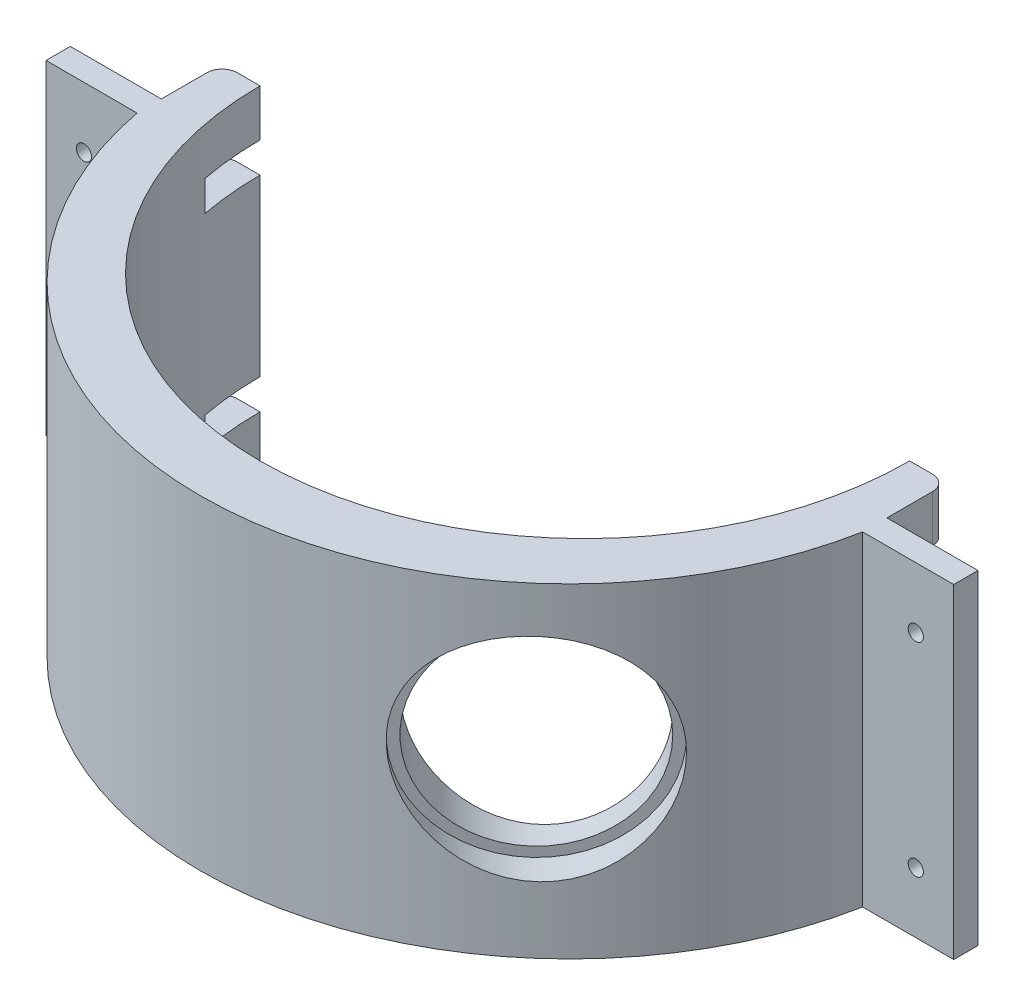
from build123d import *

# Parameters (mm, degrees)
BOSS_EXTRUDE1_DEPTH = 107
SKETCH2_R           = 2.5
CUT_EXTRUDE1_DEPTH  = 336.0337743
SKETCH3_R           = 35
CUT_EXTRUDE2_DEPTH  = 10
SKETCH4_R           = 31.778321021
CUT_EXTRUDE3_DEPTH  = 25
CUT_EXTRUDE4_REACH  = 337.034
SKETCH5_W           = 15.542799326
SKETCH5_H           = 10
SKETCH5_W_2         = 18.63674205


with BuildPart() as part:
    # Sketch1 → Boss-Extrude1 (new body)
    with BuildSketch(Plane(origin=(0, 0, 0), x_dir=(1, 0, 0), z_dir=(0, 1, 0))):
        with BuildLine():
            Line((0, 0), (0, -8))
            Line((0, -8), (30, -8))
            ThreePointArc((30, -8), (149.5, -106.759683035), (269, -8))
            Line((269, -8), (299, -8))
            Line((299, -8), (299, 0))
            Line((299, 0), (269, 0))
            Line((269, 0), (269, 15))
            ThreePointArc((269, 15), (267.535533906, 18.535533906), (264, 20))
            Line((264, 20), (256.5, 20))
            ThreePointArc((256.5, 20), (149.5, -87.000008561), (42.5, 20))
            Line((42.5, 20), (35, 20))
            ThreePointArc((35, 20), (31.464466094, 18.535533906), (30, 15))
            Line((30, 15), (30, 0))
            Line((30, 0), (0, 0))
        make_face()
    extrude(amount=BOSS_EXTRUDE1_DEPTH)

    # Sketch2 → Cut-Extrude1 (cut, through all)
    with BuildSketch(Plane(origin=(0, 0, 0), x_dir=(-1, 0, 0), z_dir=(0, 0, -1))):
        with Locations((-286.5, 87)):
            Circle(SKETCH2_R)
        with Locations((-286.5, 20)):
            Circle(SKETCH2_R)
        with Locations((-12.5, 87)):
            Circle(SKETCH2_R)
        with Locations((-12.5, 20)):
            Circle(SKETCH2_R)
    extrude(amount=-CUT_EXTRUDE1_DEPTH, mode=Mode.SUBTRACT)

    # Sketch3 → Cut-Extrude2 (cut)
    with BuildSketch(Plane(origin=(152.698962186, 0, 153.519285181), x_dir=(0.7089984938103423, 0, -0.7052099940972661), z_dir=(0.7052099940972661, 0, 0.7089984938103423))):
        with Locations((109.109605527, 56.865799068)):
            Circle(SKETCH3_R)
    extrude(amount=-CUT_EXTRUDE2_DEPTH, mode=Mode.SUBTRACT)

    # Sketch4 → Cut-Extrude3 (cut)
    with BuildSketch(Plane(origin=(145.646862245, 0, 146.429300243), x_dir=(0.7089984938103423, 0, -0.7052099940972661), z_dir=(0.7052099940972661, 0, 0.7089984938103423))):
        with Locations((109.109605527, 56.865799068)):
            Circle(SKETCH4_R)
    extrude(amount=-CUT_EXTRUDE3_DEPTH, mode=Mode.SUBTRACT)

    # Cut-Extrude4: up to this face of the body (flat: up to its plane)
    cut_extrude4_end = Plane(part.part.faces().sort_by_distance((260.25, 53.5, -20))[0])
    # Sketch5 → Cut-Extrude4 (cut, up to the picked face)
    with BuildSketch(Plane(origin=(0, 0, 0), x_dir=(-1, 0, 0), z_dir=(0, 0, -1)), mode=Mode.PRIVATE) as cut_extrude4_sk1:
        with Locations((-261.228600337, 86.535453814)):
            Rectangle(SKETCH5_W, SKETCH5_H)
    cut_extrude4_tool1 = split(extrude(cut_extrude4_sk1.sketch, amount=CUT_EXTRUDE4_REACH, mode=Mode.PRIVATE), bisect_by=cut_extrude4_end, keep=Keep.BOTH, mode=Mode.PRIVATE)
    # Sketch5 → Cut-Extrude4 (cut, up to the picked face)
    with BuildSketch(Plane(origin=(0, 0, 0), x_dir=(-1, 0, 0), z_dir=(0, 0, -1)), mode=Mode.PRIVATE) as cut_extrude4_sk2:
        with Locations((-259.681628975, 19.008712967)):
            Rectangle(SKETCH5_W_2, SKETCH5_H)
    cut_extrude4_tool2 = split(extrude(cut_extrude4_sk2.sketch, amount=CUT_EXTRUDE4_REACH, mode=Mode.PRIVATE), bisect_by=cut_extrude4_end, keep=Keep.BOTH, mode=Mode.PRIVATE)
    # Sketch5 → Cut-Extrude4 (cut, up to the picked face)
    with BuildSketch(Plane(origin=(0, 0, 0), x_dir=(-1, 0, 0), z_dir=(0, 0, -1)), mode=Mode.PRIVATE) as cut_extrude4_sk3:
        with Locations((-39.318371025, 19.008712967)):
            Rectangle(SKETCH5_W_2, SKETCH5_H)
    cut_extrude4_tool3 = split(extrude(cut_extrude4_sk3.sketch, amount=CUT_EXTRUDE4_REACH, mode=Mode.PRIVATE), bisect_by=cut_extrude4_end, keep=Keep.BOTH, mode=Mode.PRIVATE)
    # Sketch5 → Cut-Extrude4 (cut, up to the picked face)
    with BuildSketch(Plane(origin=(0, 0, 0), x_dir=(-1, 0, 0), z_dir=(0, 0, -1)), mode=Mode.PRIVATE) as cut_extrude4_sk4:
        with Locations((-37.771399663, 86.535453814)):
            Rectangle(SKETCH5_W, SKETCH5_H)
    cut_extrude4_tool4 = split(extrude(cut_extrude4_sk4.sketch, amount=CUT_EXTRUDE4_REACH, mode=Mode.PRIVATE), bisect_by=cut_extrude4_end, keep=Keep.BOTH, mode=Mode.PRIVATE)
    add(cut_extrude4_tool1.solids().sort_by(Axis((261.2286, 86.535454, 0), (0, 0, -1)))[0], mode=Mode.SUBTRACT)
    add(cut_extrude4_tool2.solids().sort_by(Axis((259.681629, 19.008713, 0), (0, 0, -1)))[0], mode=Mode.SUBTRACT)
    add(cut_extrude4_tool3.solids().sort_by(Axis((39.318371, 19.008713, 0), (0, 0, -1)))[0], mode=Mode.SUBTRACT)
    add(cut_extrude4_tool4.solids().sort_by(Axis((37.7714, 86.535454, 0), (0, 0, -1)))[0], mode=Mode.SUBTRACT)


solid = part.part
